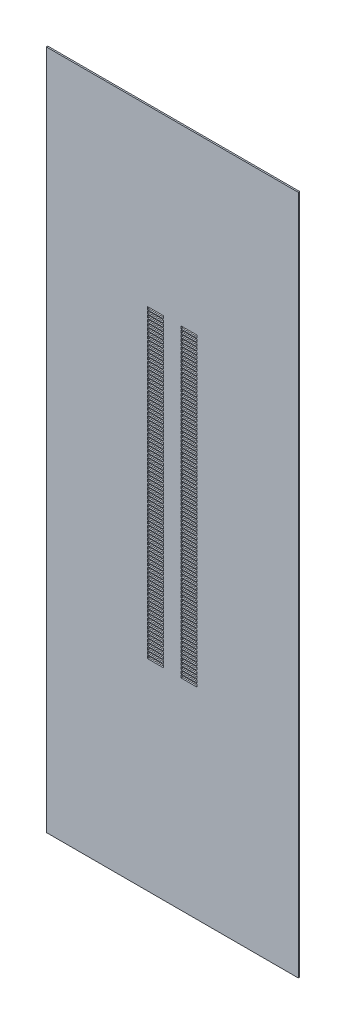
from build123d import *

# Parameters (mm, degrees)
SKETCH1_W          = 34.610490114
SKETCH1_H          = 93.442204815
SKETCH1_W_2        = 2.22
SKETCH1_H_2        = 0.37
BOSS_EXTRU_1_DEPTH = 0.2


with BuildPart() as part:
    # Sketch1 → Boss.-Extru.1 (new body)
    with BuildSketch(Plane.XY):
        with Locations((0, -22.785028526)):
            Rectangle(SKETCH1_W, SKETCH1_H)
        with Locations((-2.3, -0.185)):
            Rectangle(SKETCH1_W_2, SKETCH1_H_2, mode=Mode.SUBTRACT)
        with Locations((2.3, -0.185)):
            Rectangle(SKETCH1_W_2, SKETCH1_H_2, mode=Mode.SUBTRACT)
        with Locations((2.3, -0.685)):
            Rectangle(SKETCH1_W_2, SKETCH1_H_2, mode=Mode.SUBTRACT)
        with Locations((-2.3, -0.685)):
            Rectangle(SKETCH1_W_2, SKETCH1_H_2, mode=Mode.SUBTRACT)
        with Locations((2.3, -1.185)):
            Rectangle(SKETCH1_W_2, SKETCH1_H_2, mode=Mode.SUBTRACT)
        with Locations((-2.3, -1.185)):
            Rectangle(SKETCH1_W_2, SKETCH1_H_2, mode=Mode.SUBTRACT)
        with Locations((2.3, -1.685)):
            Rectangle(SKETCH1_W_2, SKETCH1_H_2, mode=Mode.SUBTRACT)
        with Locations((-2.3, -1.685)):
            Rectangle(SKETCH1_W_2, SKETCH1_H_2, mode=Mode.SUBTRACT)
        with Locations((2.3, -2.185)):
            Rectangle(SKETCH1_W_2, SKETCH1_H_2, mode=Mode.SUBTRACT)
        with Locations((-2.3, -2.185)):
            Rectangle(SKETCH1_W_2, SKETCH1_H_2, mode=Mode.SUBTRACT)
        with Locations((2.3, -2.685)):
            Rectangle(SKETCH1_W_2, SKETCH1_H_2, mode=Mode.SUBTRACT)
        with Locations((-2.3, -2.685)):
            Rectangle(SKETCH1_W_2, SKETCH1_H_2, mode=Mode.SUBTRACT)
        with Locations((2.3, -3.185)):
            Rectangle(SKETCH1_W_2, SKETCH1_H_2, mode=Mode.SUBTRACT)
        with Locations((-2.3, -3.185)):
            Rectangle(SKETCH1_W_2, SKETCH1_H_2, mode=Mode.SUBTRACT)
        with Locations((2.3, -3.685)):
            Rectangle(SKETCH1_W_2, SKETCH1_H_2, mode=Mode.SUBTRACT)
        with Locations((-2.3, -3.685)):
            Rectangle(SKETCH1_W_2, SKETCH1_H_2, mode=Mode.SUBTRACT)
        with Locations((2.3, -4.185)):
            Rectangle(SKETCH1_W_2, SKETCH1_H_2, mode=Mode.SUBTRACT)
        with Locations((-2.3, -4.185)):
            Rectangle(SKETCH1_W_2, SKETCH1_H_2, mode=Mode.SUBTRACT)
        with Locations((2.3, -4.685)):
            Rectangle(SKETCH1_W_2, SKETCH1_H_2, mode=Mode.SUBTRACT)
        with Locations((-2.3, -4.685)):
            Rectangle(SKETCH1_W_2, SKETCH1_H_2, mode=Mode.SUBTRACT)
        with Locations((2.3, -5.185)):
            Rectangle(SKETCH1_W_2, SKETCH1_H_2, mode=Mode.SUBTRACT)
        with Locations((-2.3, -5.185)):
            Rectangle(SKETCH1_W_2, SKETCH1_H_2, mode=Mode.SUBTRACT)
        with Locations((2.3, -5.685)):
            Rectangle(SKETCH1_W_2, SKETCH1_H_2, mode=Mode.SUBTRACT)
        with Locations((-2.3, -5.685)):
            Rectangle(SKETCH1_W_2, SKETCH1_H_2, mode=Mode.SUBTRACT)
        with Locations((2.3, -6.185)):
            Rectangle(SKETCH1_W_2, SKETCH1_H_2, mode=Mode.SUBTRACT)
        with Locations((-2.3, -6.185)):
            Rectangle(SKETCH1_W_2, SKETCH1_H_2, mode=Mode.SUBTRACT)
        with Locations((2.3, -6.685)):
            Rectangle(SKETCH1_W_2, SKETCH1_H_2, mode=Mode.SUBTRACT)
        with Locations((-2.3, -6.685)):
            Rectangle(SKETCH1_W_2, SKETCH1_H_2, mode=Mode.SUBTRACT)
        with Locations((2.3, -7.185)):
            Rectangle(SKETCH1_W_2, SKETCH1_H_2, mode=Mode.SUBTRACT)
        with Locations((-2.3, -7.185)):
            Rectangle(SKETCH1_W_2, SKETCH1_H_2, mode=Mode.SUBTRACT)
        with Locations((2.3, -7.685)):
            Rectangle(SKETCH1_W_2, SKETCH1_H_2, mode=Mode.SUBTRACT)
        with Locations((-2.3, -7.685)):
            Rectangle(SKETCH1_W_2, SKETCH1_H_2, mode=Mode.SUBTRACT)
        with Locations((2.3, -8.185)):
            Rectangle(SKETCH1_W_2, SKETCH1_H_2, mode=Mode.SUBTRACT)
        with Locations((-2.3, -8.185)):
            Rectangle(SKETCH1_W_2, SKETCH1_H_2, mode=Mode.SUBTRACT)
        with Locations((2.3, -8.685)):
            Rectangle(SKETCH1_W_2, SKETCH1_H_2, mode=Mode.SUBTRACT)
        with Locations((-2.3, -8.685)):
            Rectangle(SKETCH1_W_2, SKETCH1_H_2, mode=Mode.SUBTRACT)
        with Locations((2.3, -9.185)):
            Rectangle(SKETCH1_W_2, SKETCH1_H_2, mode=Mode.SUBTRACT)
        with Locations((-2.3, -9.185)):
            Rectangle(SKETCH1_W_2, SKETCH1_H_2, mode=Mode.SUBTRACT)
        with Locations((2.3, -9.685)):
            Rectangle(SKETCH1_W_2, SKETCH1_H_2, mode=Mode.SUBTRACT)
        with Locations((-2.3, -9.685)):
            Rectangle(SKETCH1_W_2, SKETCH1_H_2, mode=Mode.SUBTRACT)
        with Locations((2.3, -10.185)):
            Rectangle(SKETCH1_W_2, SKETCH1_H_2, mode=Mode.SUBTRACT)
        with Locations((-2.3, -10.185)):
            Rectangle(SKETCH1_W_2, SKETCH1_H_2, mode=Mode.SUBTRACT)
        with Locations((2.3, -10.685)):
            Rectangle(SKETCH1_W_2, SKETCH1_H_2, mode=Mode.SUBTRACT)
        with Locations((-2.3, -10.685)):
            Rectangle(SKETCH1_W_2, SKETCH1_H_2, mode=Mode.SUBTRACT)
        with Locations((2.3, -11.185)):
            Rectangle(SKETCH1_W_2, SKETCH1_H_2, mode=Mode.SUBTRACT)
        with Locations((-2.3, -11.185)):
            Rectangle(SKETCH1_W_2, SKETCH1_H_2, mode=Mode.SUBTRACT)
        with Locations((2.3, -11.685)):
            Rectangle(SKETCH1_W_2, SKETCH1_H_2, mode=Mode.SUBTRACT)
        with Locations((-2.3, -11.685)):
            Rectangle(SKETCH1_W_2, SKETCH1_H_2, mode=Mode.SUBTRACT)
        with Locations((2.3, -12.185)):
            Rectangle(SKETCH1_W_2, SKETCH1_H_2, mode=Mode.SUBTRACT)
        with Locations((-2.3, -12.185)):
            Rectangle(SKETCH1_W_2, SKETCH1_H_2, mode=Mode.SUBTRACT)
        with Locations((2.3, -12.685)):
            Rectangle(SKETCH1_W_2, SKETCH1_H_2, mode=Mode.SUBTRACT)
        with Locations((-2.3, -12.685)):
            Rectangle(SKETCH1_W_2, SKETCH1_H_2, mode=Mode.SUBTRACT)
        with Locations((2.3, -13.185)):
            Rectangle(SKETCH1_W_2, SKETCH1_H_2, mode=Mode.SUBTRACT)
        with Locations((-2.3, -13.185)):
            Rectangle(SKETCH1_W_2, SKETCH1_H_2, mode=Mode.SUBTRACT)
        with Locations((2.3, -13.685)):
            Rectangle(SKETCH1_W_2, SKETCH1_H_2, mode=Mode.SUBTRACT)
        with Locations((-2.3, -13.685)):
            Rectangle(SKETCH1_W_2, SKETCH1_H_2, mode=Mode.SUBTRACT)
        with Locations((2.3, -14.185)):
            Rectangle(SKETCH1_W_2, SKETCH1_H_2, mode=Mode.SUBTRACT)
        with Locations((-2.3, -14.185)):
            Rectangle(SKETCH1_W_2, SKETCH1_H_2, mode=Mode.SUBTRACT)
        with Locations((2.3, -14.685)):
            Rectangle(SKETCH1_W_2, SKETCH1_H_2, mode=Mode.SUBTRACT)
        with Locations((-2.3, -14.685)):
            Rectangle(SKETCH1_W_2, SKETCH1_H_2, mode=Mode.SUBTRACT)
        with Locations((2.3, -15.185)):
            Rectangle(SKETCH1_W_2, SKETCH1_H_2, mode=Mode.SUBTRACT)
        with Locations((-2.3, -15.185)):
            Rectangle(SKETCH1_W_2, SKETCH1_H_2, mode=Mode.SUBTRACT)
        with Locations((2.3, -15.685)):
            Rectangle(SKETCH1_W_2, SKETCH1_H_2, mode=Mode.SUBTRACT)
        with Locations((-2.3, -15.685)):
            Rectangle(SKETCH1_W_2, SKETCH1_H_2, mode=Mode.SUBTRACT)
        with Locations((2.3, -16.185)):
            Rectangle(SKETCH1_W_2, SKETCH1_H_2, mode=Mode.SUBTRACT)
        with Locations((-2.3, -16.185)):
            Rectangle(SKETCH1_W_2, SKETCH1_H_2, mode=Mode.SUBTRACT)
        with Locations((2.3, -16.685)):
            Rectangle(SKETCH1_W_2, SKETCH1_H_2, mode=Mode.SUBTRACT)
        with Locations((-2.3, -16.685)):
            Rectangle(SKETCH1_W_2, SKETCH1_H_2, mode=Mode.SUBTRACT)
        with Locations((2.3, -17.185)):
            Rectangle(SKETCH1_W_2, SKETCH1_H_2, mode=Mode.SUBTRACT)
        with Locations((-2.3, -17.185)):
            Rectangle(SKETCH1_W_2, SKETCH1_H_2, mode=Mode.SUBTRACT)
        with Locations((2.3, -17.685)):
            Rectangle(SKETCH1_W_2, SKETCH1_H_2, mode=Mode.SUBTRACT)
        with Locations((-2.3, -17.685)):
            Rectangle(SKETCH1_W_2, SKETCH1_H_2, mode=Mode.SUBTRACT)
        with Locations((2.3, -18.185)):
            Rectangle(SKETCH1_W_2, SKETCH1_H_2, mode=Mode.SUBTRACT)
        with Locations((-2.3, -18.185)):
            Rectangle(SKETCH1_W_2, SKETCH1_H_2, mode=Mode.SUBTRACT)
        with Locations((2.3, -18.685)):
            Rectangle(SKETCH1_W_2, SKETCH1_H_2, mode=Mode.SUBTRACT)
        with Locations((-2.3, -18.685)):
            Rectangle(SKETCH1_W_2, SKETCH1_H_2, mode=Mode.SUBTRACT)
        with Locations((2.3, -19.185)):
            Rectangle(SKETCH1_W_2, SKETCH1_H_2, mode=Mode.SUBTRACT)
        with Locations((-2.3, -19.185)):
            Rectangle(SKETCH1_W_2, SKETCH1_H_2, mode=Mode.SUBTRACT)
        with Locations((2.3, -19.685)):
            Rectangle(SKETCH1_W_2, SKETCH1_H_2, mode=Mode.SUBTRACT)
        with Locations((-2.3, -19.685)):
            Rectangle(SKETCH1_W_2, SKETCH1_H_2, mode=Mode.SUBTRACT)
        with Locations((2.3, -20.185)):
            Rectangle(SKETCH1_W_2, SKETCH1_H_2, mode=Mode.SUBTRACT)
        with Locations((-2.3, -20.185)):
            Rectangle(SKETCH1_W_2, SKETCH1_H_2, mode=Mode.SUBTRACT)
        with Locations((2.3, -20.685)):
            Rectangle(SKETCH1_W_2, SKETCH1_H_2, mode=Mode.SUBTRACT)
        with Locations((-2.3, -20.685)):
            Rectangle(SKETCH1_W_2, SKETCH1_H_2, mode=Mode.SUBTRACT)
        with Locations((2.3, -21.185)):
            Rectangle(SKETCH1_W_2, SKETCH1_H_2, mode=Mode.SUBTRACT)
        with Locations((-2.3, -21.185)):
            Rectangle(SKETCH1_W_2, SKETCH1_H_2, mode=Mode.SUBTRACT)
        with Locations((2.3, -21.685)):
            Rectangle(SKETCH1_W_2, SKETCH1_H_2, mode=Mode.SUBTRACT)
        with Locations((-2.3, -21.685)):
            Rectangle(SKETCH1_W_2, SKETCH1_H_2, mode=Mode.SUBTRACT)
        with Locations((2.3, -22.185)):
            Rectangle(SKETCH1_W_2, SKETCH1_H_2, mode=Mode.SUBTRACT)
        with Locations((-2.3, -22.185)):
            Rectangle(SKETCH1_W_2, SKETCH1_H_2, mode=Mode.SUBTRACT)
        with Locations((2.3, -22.685)):
            Rectangle(SKETCH1_W_2, SKETCH1_H_2, mode=Mode.SUBTRACT)
        with Locations((-2.3, -22.685)):
            Rectangle(SKETCH1_W_2, SKETCH1_H_2, mode=Mode.SUBTRACT)
        with Locations((2.3, -23.185)):
            Rectangle(SKETCH1_W_2, SKETCH1_H_2, mode=Mode.SUBTRACT)
        with Locations((-2.3, -23.185)):
            Rectangle(SKETCH1_W_2, SKETCH1_H_2, mode=Mode.SUBTRACT)
        with Locations((2.3, -23.685)):
            Rectangle(SKETCH1_W_2, SKETCH1_H_2, mode=Mode.SUBTRACT)
        with Locations((-2.3, -23.685)):
            Rectangle(SKETCH1_W_2, SKETCH1_H_2, mode=Mode.SUBTRACT)
        with Locations((2.3, -24.185)):
            Rectangle(SKETCH1_W_2, SKETCH1_H_2, mode=Mode.SUBTRACT)
        with Locations((-2.3, -24.185)):
            Rectangle(SKETCH1_W_2, SKETCH1_H_2, mode=Mode.SUBTRACT)
        with Locations((2.3, -24.685)):
            Rectangle(SKETCH1_W_2, SKETCH1_H_2, mode=Mode.SUBTRACT)
        with Locations((-2.3, -24.685)):
            Rectangle(SKETCH1_W_2, SKETCH1_H_2, mode=Mode.SUBTRACT)
        with Locations((2.3, -25.185)):
            Rectangle(SKETCH1_W_2, SKETCH1_H_2, mode=Mode.SUBTRACT)
        with Locations((-2.3, -25.185)):
            Rectangle(SKETCH1_W_2, SKETCH1_H_2, mode=Mode.SUBTRACT)
        with Locations((2.3, -25.685)):
            Rectangle(SKETCH1_W_2, SKETCH1_H_2, mode=Mode.SUBTRACT)
        with Locations((-2.3, -25.685)):
            Rectangle(SKETCH1_W_2, SKETCH1_H_2, mode=Mode.SUBTRACT)
        with Locations((2.3, -26.185)):
            Rectangle(SKETCH1_W_2, SKETCH1_H_2, mode=Mode.SUBTRACT)
        with Locations((-2.3, -26.185)):
            Rectangle(SKETCH1_W_2, SKETCH1_H_2, mode=Mode.SUBTRACT)
        with Locations((2.3, -26.685)):
            Rectangle(SKETCH1_W_2, SKETCH1_H_2, mode=Mode.SUBTRACT)
        with Locations((-2.3, -26.685)):
            Rectangle(SKETCH1_W_2, SKETCH1_H_2, mode=Mode.SUBTRACT)
        with Locations((2.3, -27.185)):
            Rectangle(SKETCH1_W_2, SKETCH1_H_2, mode=Mode.SUBTRACT)
        with Locations((-2.3, -27.185)):
            Rectangle(SKETCH1_W_2, SKETCH1_H_2, mode=Mode.SUBTRACT)
        with Locations((2.3, -27.685)):
            Rectangle(SKETCH1_W_2, SKETCH1_H_2, mode=Mode.SUBTRACT)
        with Locations((-2.3, -27.685)):
            Rectangle(SKETCH1_W_2, SKETCH1_H_2, mode=Mode.SUBTRACT)
        with Locations((2.3, -28.185)):
            Rectangle(SKETCH1_W_2, SKETCH1_H_2, mode=Mode.SUBTRACT)
        with Locations((-2.3, -28.185)):
            Rectangle(SKETCH1_W_2, SKETCH1_H_2, mode=Mode.SUBTRACT)
        with Locations((2.3, -28.685)):
            Rectangle(SKETCH1_W_2, SKETCH1_H_2, mode=Mode.SUBTRACT)
        with Locations((-2.3, -28.685)):
            Rectangle(SKETCH1_W_2, SKETCH1_H_2, mode=Mode.SUBTRACT)
        with Locations((2.3, -29.185)):
            Rectangle(SKETCH1_W_2, SKETCH1_H_2, mode=Mode.SUBTRACT)
        with Locations((-2.3, -29.185)):
            Rectangle(SKETCH1_W_2, SKETCH1_H_2, mode=Mode.SUBTRACT)
        with Locations((2.3, -29.685)):
            Rectangle(SKETCH1_W_2, SKETCH1_H_2, mode=Mode.SUBTRACT)
        with Locations((-2.3, -29.685)):
            Rectangle(SKETCH1_W_2, SKETCH1_H_2, mode=Mode.SUBTRACT)
        with Locations((2.3, -30.185)):
            Rectangle(SKETCH1_W_2, SKETCH1_H_2, mode=Mode.SUBTRACT)
        with Locations((-2.3, -30.185)):
            Rectangle(SKETCH1_W_2, SKETCH1_H_2, mode=Mode.SUBTRACT)
        with Locations((2.3, -30.685)):
            Rectangle(SKETCH1_W_2, SKETCH1_H_2, mode=Mode.SUBTRACT)
        with Locations((-2.3, -30.685)):
            Rectangle(SKETCH1_W_2, SKETCH1_H_2, mode=Mode.SUBTRACT)
        with Locations((2.3, -31.185)):
            Rectangle(SKETCH1_W_2, SKETCH1_H_2, mode=Mode.SUBTRACT)
        with Locations((-2.3, -31.185)):
            Rectangle(SKETCH1_W_2, SKETCH1_H_2, mode=Mode.SUBTRACT)
        with Locations((2.3, -31.685)):
            Rectangle(SKETCH1_W_2, SKETCH1_H_2, mode=Mode.SUBTRACT)
        with Locations((-2.3, -31.685)):
            Rectangle(SKETCH1_W_2, SKETCH1_H_2, mode=Mode.SUBTRACT)
        with Locations((2.3, -32.185)):
            Rectangle(SKETCH1_W_2, SKETCH1_H_2, mode=Mode.SUBTRACT)
        with Locations((-2.3, -32.185)):
            Rectangle(SKETCH1_W_2, SKETCH1_H_2, mode=Mode.SUBTRACT)
        with Locations((2.3, -32.685)):
            Rectangle(SKETCH1_W_2, SKETCH1_H_2, mode=Mode.SUBTRACT)
        with Locations((-2.3, -32.685)):
            Rectangle(SKETCH1_W_2, SKETCH1_H_2, mode=Mode.SUBTRACT)
        with Locations((2.3, -33.185)):
            Rectangle(SKETCH1_W_2, SKETCH1_H_2, mode=Mode.SUBTRACT)
        with Locations((-2.3, -33.185)):
            Rectangle(SKETCH1_W_2, SKETCH1_H_2, mode=Mode.SUBTRACT)
        with Locations((2.3, -33.685)):
            Rectangle(SKETCH1_W_2, SKETCH1_H_2, mode=Mode.SUBTRACT)
        with Locations((-2.3, -33.685)):
            Rectangle(SKETCH1_W_2, SKETCH1_H_2, mode=Mode.SUBTRACT)
        with Locations((2.3, -34.185)):
            Rectangle(SKETCH1_W_2, SKETCH1_H_2, mode=Mode.SUBTRACT)
        with Locations((-2.3, -34.185)):
            Rectangle(SKETCH1_W_2, SKETCH1_H_2, mode=Mode.SUBTRACT)
        with Locations((2.3, -34.685)):
            Rectangle(SKETCH1_W_2, SKETCH1_H_2, mode=Mode.SUBTRACT)
        with Locations((-2.3, -34.685)):
            Rectangle(SKETCH1_W_2, SKETCH1_H_2, mode=Mode.SUBTRACT)
        with Locations((2.3, -35.185)):
            Rectangle(SKETCH1_W_2, SKETCH1_H_2, mode=Mode.SUBTRACT)
        with Locations((-2.3, -35.185)):
            Rectangle(SKETCH1_W_2, SKETCH1_H_2, mode=Mode.SUBTRACT)
        with Locations((2.3, -35.685)):
            Rectangle(SKETCH1_W_2, SKETCH1_H_2, mode=Mode.SUBTRACT)
        with Locations((-2.3, -35.685)):
            Rectangle(SKETCH1_W_2, SKETCH1_H_2, mode=Mode.SUBTRACT)
        with Locations((2.3, -36.185)):
            Rectangle(SKETCH1_W_2, SKETCH1_H_2, mode=Mode.SUBTRACT)
        with Locations((-2.3, -36.185)):
            Rectangle(SKETCH1_W_2, SKETCH1_H_2, mode=Mode.SUBTRACT)
        with Locations((2.3, -36.685)):
            Rectangle(SKETCH1_W_2, SKETCH1_H_2, mode=Mode.SUBTRACT)
        with Locations((-2.3, -36.685)):
            Rectangle(SKETCH1_W_2, SKETCH1_H_2, mode=Mode.SUBTRACT)
        with Locations((2.3, -37.185)):
            Rectangle(SKETCH1_W_2, SKETCH1_H_2, mode=Mode.SUBTRACT)
        with Locations((-2.3, -37.185)):
            Rectangle(SKETCH1_W_2, SKETCH1_H_2, mode=Mode.SUBTRACT)
        with Locations((2.3, -37.685)):
            Rectangle(SKETCH1_W_2, SKETCH1_H_2, mode=Mode.SUBTRACT)
        with Locations((-2.3, -37.685)):
            Rectangle(SKETCH1_W_2, SKETCH1_H_2, mode=Mode.SUBTRACT)
        with Locations((2.3, -38.185)):
            Rectangle(SKETCH1_W_2, SKETCH1_H_2, mode=Mode.SUBTRACT)
        with Locations((-2.3, -38.185)):
            Rectangle(SKETCH1_W_2, SKETCH1_H_2, mode=Mode.SUBTRACT)
        with Locations((2.3, -38.685)):
            Rectangle(SKETCH1_W_2, SKETCH1_H_2, mode=Mode.SUBTRACT)
        with Locations((-2.3, -38.685)):
            Rectangle(SKETCH1_W_2, SKETCH1_H_2, mode=Mode.SUBTRACT)
        with Locations((2.3, -39.185)):
            Rectangle(SKETCH1_W_2, SKETCH1_H_2, mode=Mode.SUBTRACT)
        with Locations((-2.3, -39.185)):
            Rectangle(SKETCH1_W_2, SKETCH1_H_2, mode=Mode.SUBTRACT)
        with Locations((2.3, -39.685)):
            Rectangle(SKETCH1_W_2, SKETCH1_H_2, mode=Mode.SUBTRACT)
        with Locations((-2.3, -39.685)):
            Rectangle(SKETCH1_W_2, SKETCH1_H_2, mode=Mode.SUBTRACT)
        with Locations((2.3, -40.185)):
            Rectangle(SKETCH1_W_2, SKETCH1_H_2, mode=Mode.SUBTRACT)
        with Locations((-2.3, -40.185)):
            Rectangle(SKETCH1_W_2, SKETCH1_H_2, mode=Mode.SUBTRACT)
        with Locations((2.3, -40.685)):
            Rectangle(SKETCH1_W_2, SKETCH1_H_2, mode=Mode.SUBTRACT)
        with Locations((-2.3, -40.685)):
            Rectangle(SKETCH1_W_2, SKETCH1_H_2, mode=Mode.SUBTRACT)
        with Locations((2.3, -41.185)):
            Rectangle(SKETCH1_W_2, SKETCH1_H_2, mode=Mode.SUBTRACT)
        with Locations((-2.3, -41.185)):
            Rectangle(SKETCH1_W_2, SKETCH1_H_2, mode=Mode.SUBTRACT)
        with Locations((2.3, -41.685)):
            Rectangle(SKETCH1_W_2, SKETCH1_H_2, mode=Mode.SUBTRACT)
        with Locations((-2.3, -41.685)):
            Rectangle(SKETCH1_W_2, SKETCH1_H_2, mode=Mode.SUBTRACT)
    extrude(amount=BOSS_EXTRU_1_DEPTH)


solid = part.part
